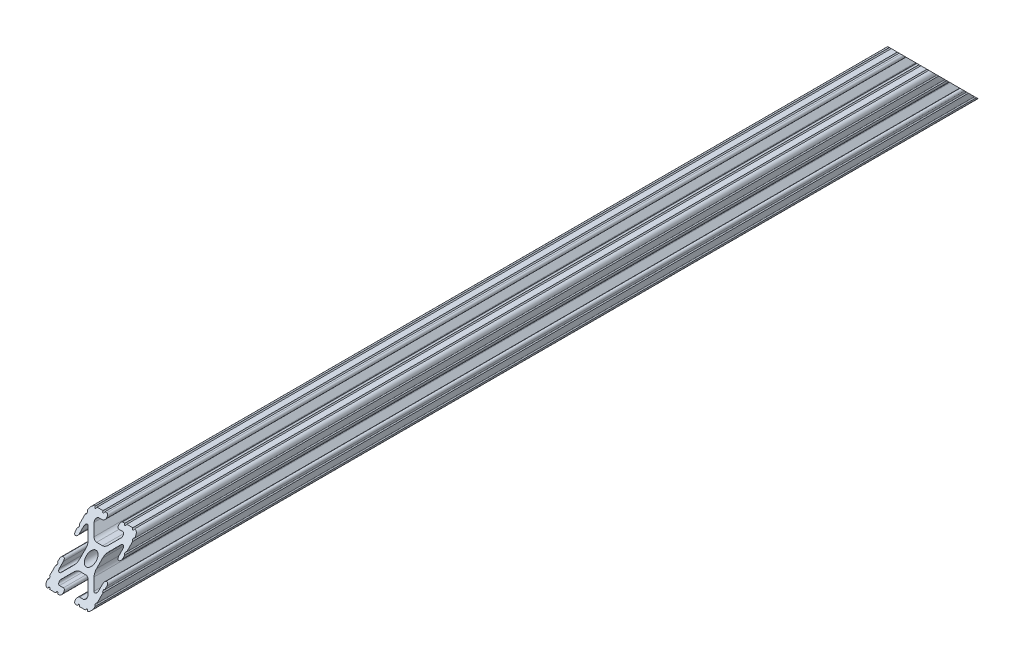
from build123d import *

# Parameters (mm, degrees)
SKETCH1_R           = 2.6035
BOSS_EXTRUDE1_DEPTH = 475.82582
SKETCH2_W           = 64.104709227
SKETCH2_H           = 106.42431428
CUT_EXTRUDE1_DEPTH  = 27.94
SKETCH3_W           = 131.394745622
SKETCH3_H           = 146.966910197
CUT_EXTRUDE2_DEPTH  = 24.638


with BuildPart() as part:
    # Sketch1 → Boss-Extrude1 (new body)
    with BuildSketch(Plane.XY):
        with BuildLine():
            Line((-12.7, -6.3330836), (-12.7, -9.5504))
            ThreePointArc((-12.7, -9.5504), (-12.192000006, -10.058323491), (-12.699846982, -10.566399977))
            ThreePointArc((-12.699846982, -10.566399977), (-12.082522516, -12.082522516), (-10.566399977, -12.699846982))
            ThreePointArc((-10.566399977, -12.699846982), (-10.058323491, -12.192000006), (-9.5504, -12.7))
            Line((-9.5504, -12.7), (-6.3330836, -12.7))
            ThreePointArc((-6.3330836, -12.7), (-5.8250836, -12.192), (-5.3170836, -12.7))
            Line((-5.3170836, -12.7), (-4.343399971, -12.7))
            ThreePointArc((-4.343399971, -12.7), (-3.238499971, -11.5951), (-4.343399971, -10.4902))
            Line((-4.343399971, -10.4902), (-6.474794456, -10.4902))
            ThreePointArc((-6.474794456, -10.4902), (-7.413456061, -9.863006367), (-7.193214945, -8.75577951))
            Line((-7.193214945, -8.75577951), (-3.863171405, -5.42573597))
            ThreePointArc((-3.863171405, -5.42573597), (-2.833127272, -4.737482484), (-1.618107374, -4.4958))
            Line((-1.618107374, -4.4958), (1.618107374, -4.4958))
            ThreePointArc((1.618107374, -4.4958), (2.833127272, -4.737482484), (3.863171405, -5.42573597))
            Line((3.863171405, -5.42573597), (7.193214945, -8.75577951))
            ThreePointArc((7.193214945, -8.75577951), (7.413456061, -9.863006367), (6.474794456, -10.4902))
            Line((6.474794456, -10.4902), (4.3434, -10.4902))
            ThreePointArc((4.3434, -10.4902), (3.2385, -11.5951), (4.3434, -12.7))
            Line((4.3434, -12.7), (5.3170836, -12.7))
            ThreePointArc((5.3170836, -12.7), (5.8250836, -12.192), (6.3330836, -12.7))
            Line((6.3330836, -12.7), (9.5504, -12.7))
            ThreePointArc((9.5504, -12.7), (10.058323491, -12.192000006), (10.566399977, -12.699846982))
            ThreePointArc((10.566399977, -12.699846982), (12.082522516, -12.082522516), (12.699846982, -10.566399977))
            ThreePointArc((12.699846982, -10.566399977), (12.192000006, -10.058323491), (12.7, -9.5504))
            Line((12.7, -9.5504), (12.7, -6.3330836))
            ThreePointArc((12.7, -6.3330836), (12.192, -5.8250836), (12.7, -5.3170836))
            Line((12.7, -5.3170836), (12.7, -4.343399971))
            ThreePointArc((12.7, -4.343399971), (11.5951, -3.238499971), (10.4902, -4.343399971))
            Line((10.4902, -4.343399971), (10.4902, -6.474794456))
            ThreePointArc((10.4902, -6.474794456), (9.863006367, -7.413456061), (8.75577951, -7.193214945))
            Line((8.75577951, -7.193214945), (5.42573597, -3.863171405))
            ThreePointArc((5.42573597, -3.863171405), (4.737482484, -2.833127272), (4.4958, -1.618107374))
            Line((4.4958, -1.618107374), (4.4958, 1.618107374))
            ThreePointArc((4.4958, 1.618107374), (4.737482484, 2.833127272), (5.42573597, 3.863171405))
            Line((5.42573597, 3.863171405), (8.75577951, 7.193214945))
            ThreePointArc((8.75577951, 7.193214945), (9.863006367, 7.413456061), (10.4902, 6.474794456))
            Line((10.4902, 6.474794456), (10.4902, 4.3434))
            ThreePointArc((10.4902, 4.3434), (11.5951, 3.2385), (12.7, 4.3434))
            Line((12.7, 4.3434), (12.7, 5.3170836))
            ThreePointArc((12.7, 5.3170836), (12.192, 5.8250836), (12.7, 6.3330836))
            Line((12.7, 6.3330836), (12.7, 9.5504))
            ThreePointArc((12.7, 9.5504), (12.192000006, 10.058323491), (12.699846982, 10.566399977))
            ThreePointArc((12.699846982, 10.566399977), (12.082522516, 12.082522516), (10.566399977, 12.699846982))
            ThreePointArc((10.566399977, 12.699846982), (10.058323491, 12.192000006), (9.5504, 12.7))
            Line((9.5504, 12.7), (6.3330836, 12.7))
            ThreePointArc((6.3330836, 12.7), (5.8250836, 12.192), (5.3170836, 12.7))
            Line((5.3170836, 12.7), (4.343399971, 12.7))
            ThreePointArc((4.343399971, 12.7), (3.238499971, 11.5951), (4.343399971, 10.4902))
            Line((4.343399971, 10.4902), (6.474794456, 10.4902))
            ThreePointArc((6.474794456, 10.4902), (7.413456061, 9.863006367), (7.193214945, 8.75577951))
            Line((7.193214945, 8.75577951), (3.863171405, 5.42573597))
            ThreePointArc((3.863171405, 5.42573597), (2.833127272, 4.737482484), (1.618107374, 4.4958))
            Line((1.618107374, 4.4958), (-1.618107374, 4.4958))
            ThreePointArc((-1.618107374, 4.4958), (-2.833127272, 4.737482484), (-3.863171405, 5.42573597))
            Line((-3.863171405, 5.42573597), (-7.193214945, 8.75577951))
            ThreePointArc((-7.193214945, 8.75577951), (-7.413456061, 9.863006367), (-6.474794456, 10.4902))
            Line((-6.474794456, 10.4902), (-4.3434, 10.4902))
            ThreePointArc((-4.3434, 10.4902), (-3.2385, 11.5951), (-4.3434, 12.7))
            Line((-4.3434, 12.7), (-5.3170836, 12.7))
            ThreePointArc((-5.3170836, 12.7), (-5.8250836, 12.192), (-6.3330836, 12.7))
            Line((-6.3330836, 12.7), (-9.5504, 12.7))
            ThreePointArc((-9.5504, 12.7), (-10.058323491, 12.192000006), (-10.566399977, 12.699846982))
            ThreePointArc((-10.566399977, 12.699846982), (-12.082522516, 12.082522516), (-12.699846982, 10.566399977))
            ThreePointArc((-12.699846982, 10.566399977), (-12.192000006, 10.058323491), (-12.7, 9.5504))
            Line((-12.7, 9.5504), (-12.7, 6.3330836))
            ThreePointArc((-12.7, 6.3330836), (-12.192, 5.8250836), (-12.7, 5.3170836))
            Line((-12.7, 5.3170836), (-12.7, 4.343399971))
            ThreePointArc((-12.7, 4.343399971), (-11.5951, 3.238499971), (-10.4902, 4.343399971))
            Line((-10.4902, 4.343399971), (-10.4902, 6.474794456))
            ThreePointArc((-10.4902, 6.474794456), (-9.863006367, 7.413456061), (-8.75577951, 7.193214945))
            Line((-8.75577951, 7.193214945), (-5.42573597, 3.863171405))
            ThreePointArc((-5.42573597, 3.863171405), (-4.737482484, 2.833127272), (-4.4958, 1.618107374))
            Line((-4.4958, 1.618107374), (-4.4958, -1.618107374))
            ThreePointArc((-4.4958, -1.618107374), (-4.737482484, -2.833127272), (-5.42573597, -3.863171405))
            Line((-5.42573597, -3.863171405), (-8.75577951, -7.193214945))
            ThreePointArc((-8.75577951, -7.193214945), (-9.863006367, -7.413456061), (-10.4902, -6.474794456))
            Line((-10.4902, -6.474794456), (-10.4902, -4.3434))
            ThreePointArc((-10.4902, -4.3434), (-11.5951, -3.2385), (-12.7, -4.3434))
            Line((-12.7, -4.3434), (-12.7, -5.3170836))
            ThreePointArc((-12.7, -5.3170836), (-12.192, -5.8250836), (-12.7, -6.3330836))
        make_face()
        with Locations(Location((0, 0, 0), (0, 0, 180))):
            Circle(SKETCH1_R, mode=Mode.SUBTRACT)
    extrude(amount=-BOSS_EXTRUDE1_DEPTH)

    # Sketch2 → Cut-Extrude1 (cut)
    with BuildSketch(Plane(origin=(0, -6.35, -6.35), x_dir=(1, 0, 0), z_dir=(0, 0.7071067811865475, 0.7071067811865477))):
        with Locations((5.773405489, 36.606923958)):
            Rectangle(SKETCH2_W, SKETCH2_H)
    extrude(amount=CUT_EXTRUDE1_DEPTH, mode=Mode.SUBTRACT)

    # Sketch3 → Cut-Extrude2 (cut)
    with BuildSketch(Plane(origin=(0, 231.56291, -231.56291), x_dir=(-1, 0, 0), z_dir=(0, 0.7071067811865475, -0.7071067811865477))):
        with Locations((23.491787854, -342.928759771)):
            Rectangle(SKETCH3_W, SKETCH3_H)
    extrude(amount=CUT_EXTRUDE2_DEPTH, mode=Mode.SUBTRACT)


solid = part.part
